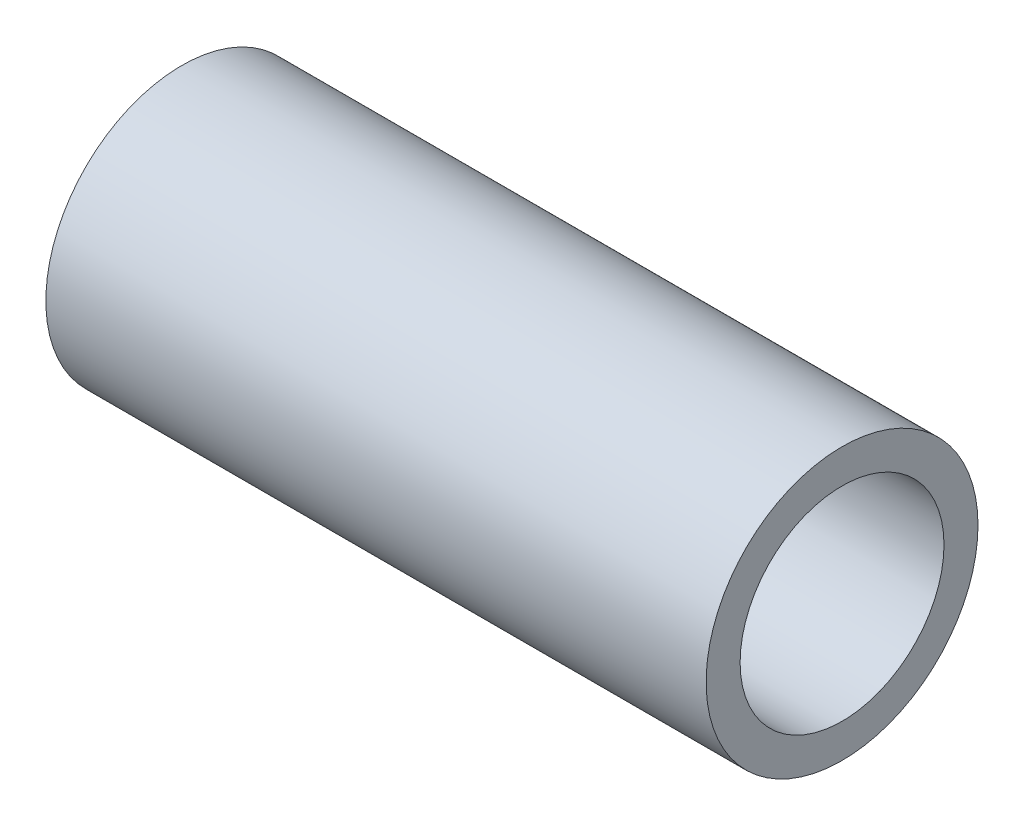
from build123d import *

# Parameters (mm, degrees)
SKETCH1_R           = 7
SKETCH1_R_2         = 5.25
BOSS_EXTRUDE1_DEPTH = 34


with BuildPart() as part:
    # Sketch1 → Boss-Extrude1 (new body)
    with BuildSketch(Plane(origin=(0, 0, 0), x_dir=(0, 0, -1), z_dir=(1, 0, 0))):
        Circle(SKETCH1_R)
        Circle(SKETCH1_R_2, mode=Mode.SUBTRACT)
    extrude(amount=BOSS_EXTRUDE1_DEPTH)


solid = part.part
